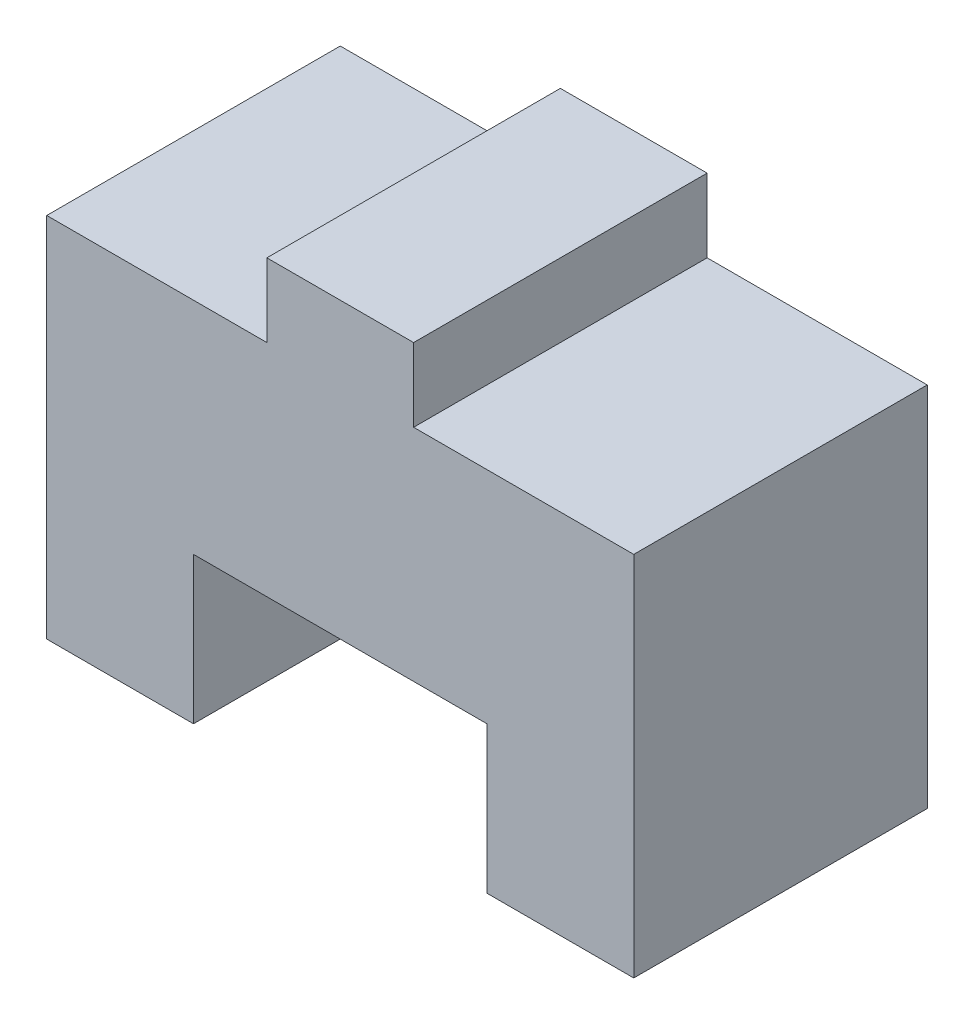
from build123d import *

# Parameters (mm, degrees)
BOSS_EXTRUDE1_DEPTH = 20


with BuildPart() as part:
    # Sketch1 → Boss-Extrude1 (new body)
    with BuildSketch(Plane.XY):
        Polygon((0, 0), (10, 0), (10, 10), (30, 10), (30, 0), (40, 0), (40, 25), (25, 25), (25, 30), (15, 30), (15, 25), (0, 25), align=None)
    extrude(amount=BOSS_EXTRUDE1_DEPTH)


solid = part.part
